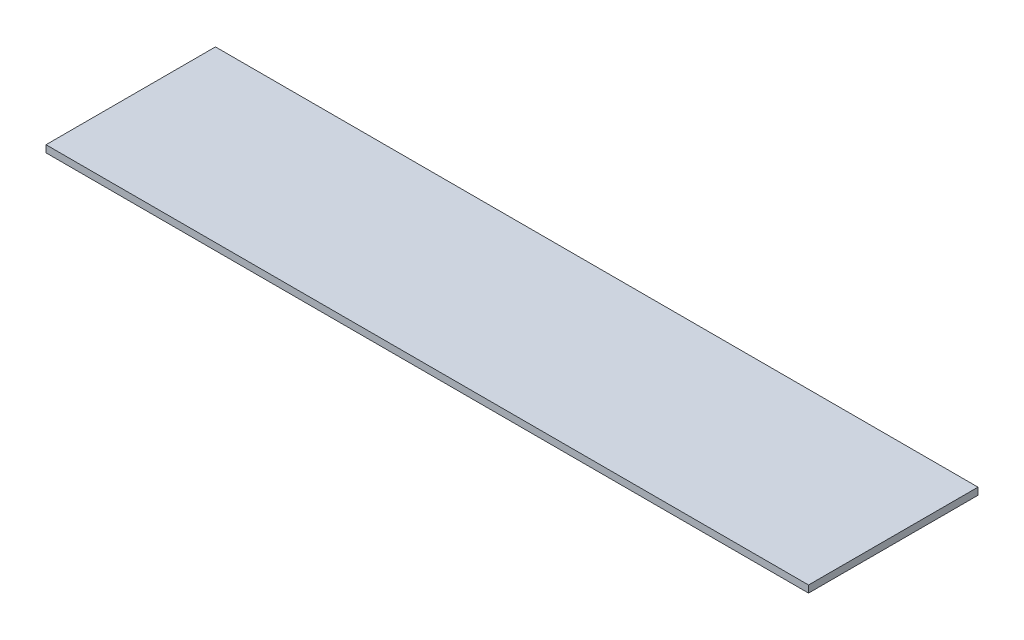
from build123d import *

# Parameters (mm, degrees)
SKETCH1_W      = 1371.6
SKETCH1_H      = 304.8
EXTRUDE1_DEPTH = 12.7


with BuildPart() as part:
    # Sketch1 → Extrude1 (new body)
    with BuildSketch(Plane(origin=(0, 0, 0), x_dir=(1, 0, 0), z_dir=(0, 1, 0))):
        Rectangle(SKETCH1_W, SKETCH1_H)
    extrude(amount=-EXTRUDE1_DEPTH)


solid = part.part
